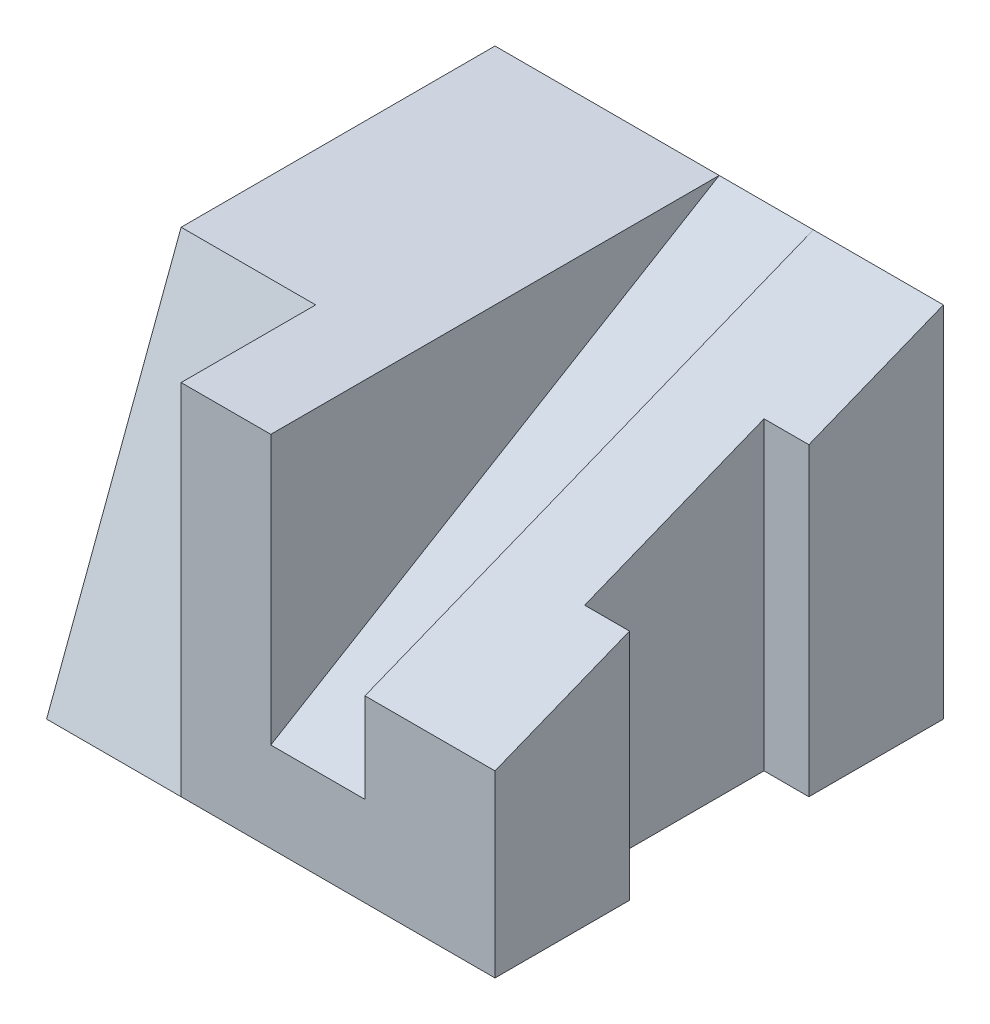
from build123d import *

# Parameters (mm, degrees)
SKETCH1_W               = 100
SKETCH1_H               = 80
BOSS_EXTRUDE1_DEPTH     = 100
CUT_EXTRUDE1_DEPTH      = 30
CUT_EXTRUDE2_DEPTH      = 50
CUT_EXTRUDE4_DEPTH      = 1
CUT_EXTRUDE4_DEPTH_BACK = 20
CUT_EXTRUDE4_START      = -30
CUT_EXTRUDE3_DEPTH      = 10


with BuildPart() as part:
    # Sketch1 → Boss-Extrude1 (new body)
    with BuildSketch(Plane.XY):
        with Locations((50, 40)):
            Rectangle(SKETCH1_W, SKETCH1_H)
    extrude(amount=-BOSS_EXTRUDE1_DEPTH)

    # Sketch3 → Cut-Extrude1 (cut)
    with BuildSketch(Plane.ZY):
        Polygon((0, 0), (-30, 80), (0, 80), align=None)
    extrude(amount=-CUT_EXTRUDE1_DEPTH, mode=Mode.SUBTRACT)

    # Sketch5 → Cut-Extrude2 (cut)
    with BuildSketch(Plane(origin=(100, 0, 0), x_dir=(0, 0, -1), z_dir=(1, 0, 0))):
        Polygon((0, 40), (100, 80), (0, 80), align=None)
    extrude(amount=-CUT_EXTRUDE2_DEPTH, mode=Mode.SUBTRACT)

    # Sketch8 → Cut-Extrude4 (cut, two sides: drawn at the far end of the back side and taken through both)
    with BuildSketch(Plane(origin=(100, 0, 0), x_dir=(0, 0, -1), z_dir=(1, 0, 0)).offset(CUT_EXTRUDE4_START - CUT_EXTRUDE4_DEPTH_BACK)):
        Polygon((0, 20), (100, 80), (0, 40), align=None)
    extrude(amount=CUT_EXTRUDE4_DEPTH + CUT_EXTRUDE4_DEPTH_BACK, mode=Mode.SUBTRACT)

    # Sketch7 → Cut-Extrude3 (cut)
    with BuildSketch(Plane(origin=(100, 0, 0), x_dir=(0, 0, -1), z_dir=(1, 0, 0))):
        Polygon((30, 52), (30, 0), (70, 0), (70, 68), align=None)
    extrude(amount=-CUT_EXTRUDE3_DEPTH, mode=Mode.SUBTRACT)


solid = part.part
